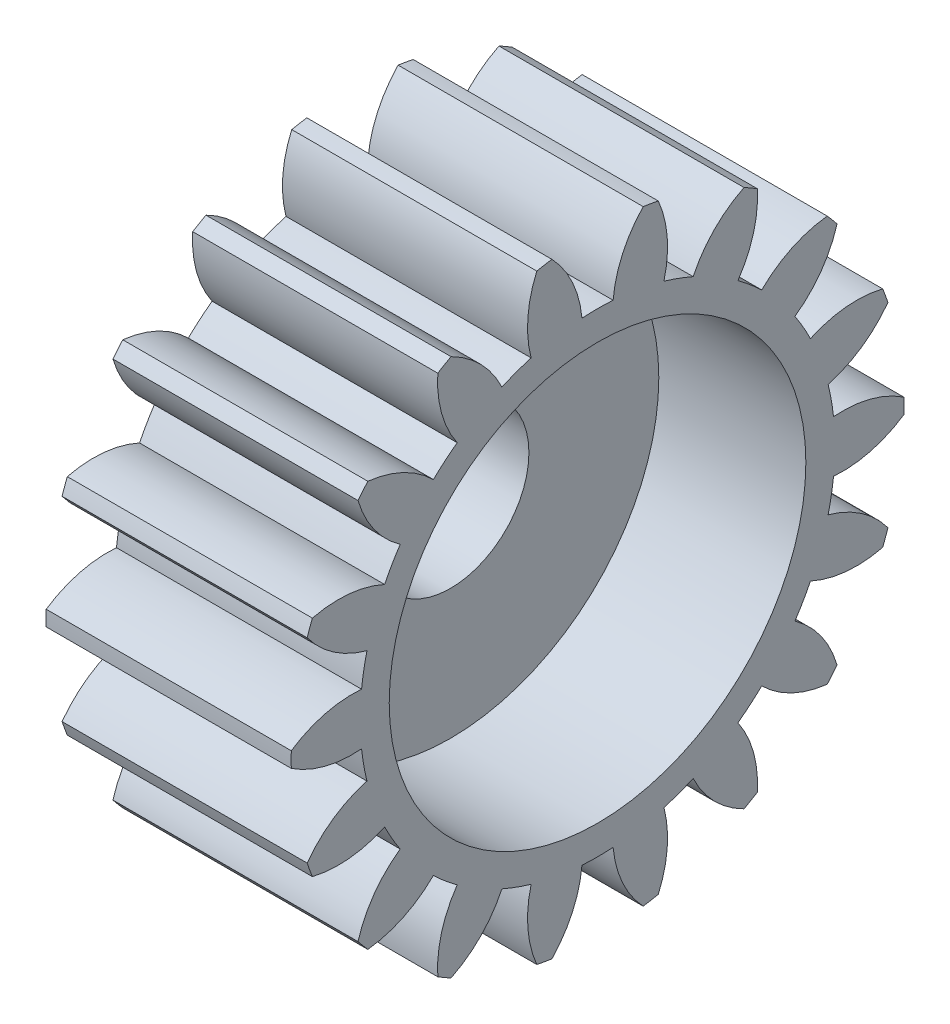
from build123d import *

# Parameters (mm, degrees)
BASPROSKE_W        = 10
BASPROSKE_H        = 12.5
TOOTHCUT_DEPTH     = 21.310096012
TEETHCUTS_COUNT    = 18
TEETHCUTS_ANGLE    = 340
BORSKE_R           = 1.5
BORE_DEPTH         = 50.0000508
SKETCH1_R          = 8.5
CUT_EXTRUDE1_DEPTH = 6
SKETCH2_R          = 3.2
CUT_EXTRUDE2_DEPTH = 19.575045867


with BuildPart() as part:
    # BasProSke → Base-Revolve (revolve)
    with BuildSketch(Plane(origin=(0, 0, 0), x_dir=(1, 0, 0), z_dir=(0, 1, 0)), mode=Mode.PRIVATE) as base_revolve_sk:
        with Locations((5, 6.25)):
            Rectangle(BASPROSKE_W, BASPROSKE_H)
    revolve(base_revolve_sk.sketch.rotate(Axis((-10, 0, 0), (1, 0, 0)), 180), axis=Axis((-10, 0, 0), (1, 0, 0)))

    # TooCutSke → ToothCut (cut, through all)
    with BuildSketch(Plane(origin=(0, 0, 0), x_dir=(0, 0, -1), z_dir=(1, 0, 0))):
        with BuildLine():
            ThreePointArc((0.634554124, 9.665693111), (0, 9.6865), (-0.634554124, 9.665693111))
            ThreePointArc((-0.634554124, 9.665693111), (-1.026818848, 11.131124412), (-1.883745888, 12.38293772))
            ThreePointArc((-1.883745888, 12.38293772), (0, 12.5254), (1.883745888, 12.38293772))
            ThreePointArc((1.883745888, 12.38293772), (1.026818848, 11.131124412), (0.634554124, 9.665693111))
        make_face()
    toothcut = extrude(amount=TOOTHCUT_DEPTH, mode=Mode.SUBTRACT)

    # TeethCuts: ToothCut ×18 about axis
    teethcuts_axis = Axis((-10, 0, 0), (1, 0, 0))
    for i in range(1, TEETHCUTS_COUNT):
        add(toothcut.rotate(teethcuts_axis, i * TEETHCUTS_ANGLE / (TEETHCUTS_COUNT - 1)), mode=Mode.SUBTRACT)

    # BorSke → Bore (cut, symmetric)
    with BuildSketch(Plane(origin=(0, 0, 0), x_dir=(0, 0, -1), z_dir=(1, 0, 0))):
        with Locations(Location((0, 0, 0), (0, 0, 180))):
            Circle(BORSKE_R)
    extrude(amount=BORE_DEPTH, both=True, mode=Mode.SUBTRACT)

    # Sketch1 → Cut-Extrude1 (cut)
    with BuildSketch(Plane(origin=(10, 0, 0), x_dir=(0, 0, -1), z_dir=(1, 0, 0))):
        Circle(SKETCH1_R)
    extrude(amount=-CUT_EXTRUDE1_DEPTH, mode=Mode.SUBTRACT)

    # Sketch2 → Cut-Extrude2 (cut, through all)
    with BuildSketch(Plane(origin=(4, 0, 0), x_dir=(0, 0, -1), z_dir=(1, 0, 0))):
        Circle(SKETCH2_R)
    extrude(amount=-CUT_EXTRUDE2_DEPTH, mode=Mode.SUBTRACT)


solid = part.part
